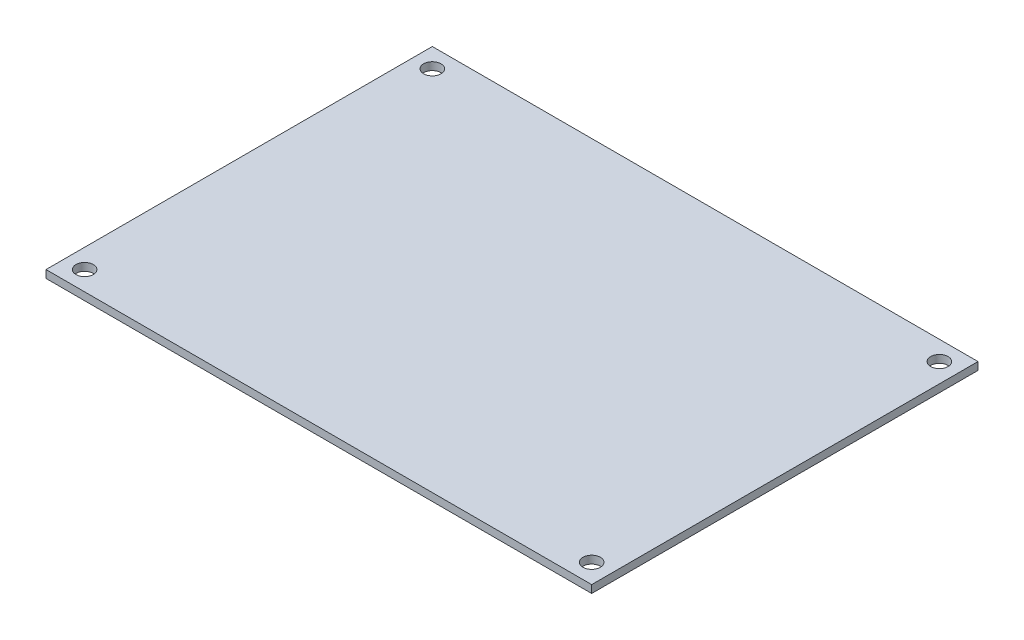
from build123d import *

# Parameters (mm, degrees)
SKETCH1_W            = 113
SKETCH1_H            = 80
BOSS_EXTRUDE1_DEPTH  = 1.6
M3_CLEARANCE_HOLE1_D = 3.6
MIRROR2_COPY_1_D     = 3.6


with BuildPart() as part:
    # Sketch1 → Boss-Extrude1 (new body)
    with BuildSketch(Plane(origin=(0, 0, 0), x_dir=(1, 0, 0), z_dir=(0, 1, 0))):
        Rectangle(SKETCH1_W, SKETCH1_H)
    extrude(amount=BOSS_EXTRUDE1_DEPTH)

    # M3 Clearance Hole1 (through all)
    with Locations(Plane(origin=(0, 1.6, 0), x_dir=(1, 0, 0), z_dir=(0, 1, 0))):
        with Locations((-52.5, 36)):
            m3_clearance_hole1 = Hole(M3_CLEARANCE_HOLE1_D / 2)

    # Mirror1: M3 Clearance Hole1 across plane
    add(m3_clearance_hole1.mirror(Plane(origin=(0, 0, 0), x_dir=(0, 0, 1), z_dir=(1, 0, 0))), mode=Mode.SUBTRACT)

    # Mirror2: M3 Clearance Hole1 across plane
    add(m3_clearance_hole1.mirror(Plane.XY), mode=Mode.SUBTRACT)

    # Mirror2 copy 1 (through all)
    with Locations(Plane(origin=(0, 1.6, 0), x_dir=(-1, 0, 0), z_dir=(0, 1, 0))):
        with Locations((-52.5, 36)):
            Hole(MIRROR2_COPY_1_D / 2)


solid = part.part
